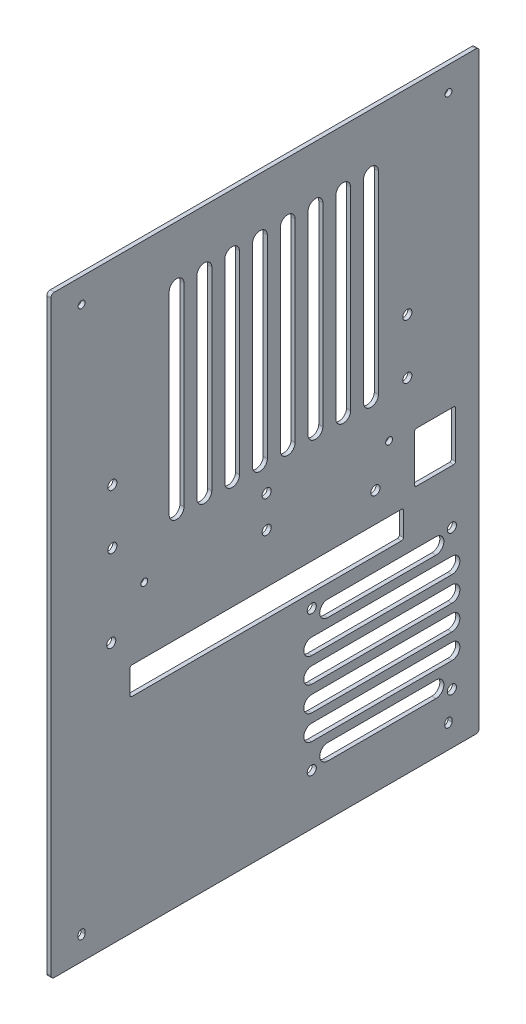
from build123d import *

# Parameters (mm, degrees)
SKETCH_1_W             = 188
SKETCH_1_H             = 260.5
BASE_DEPTH             = 1.8
SKETCH_3_R             = 1.525
SKETCH_3_R_2           = 2
SKETCH_3_R_3           = 1.5
SKETCH_3_W             = 120
SKETCH_3_H             = 12
PCIE_DEPTH             = 1.8
CUT_EXTRUDE_2024_REACH = 323.259
SKETCH_5_W             = 18
SKETCH_5_H             = 22
CUT_EXTRUDE_3211_REACH = 323.259
SKETCH_4_R             = 2
THER_DEPTH             = 1.8
FILLET_1_R             = 1.5
FILLET_2_R             = 0.8


with BuildPart() as part:
    # 草图1 → base (new body)
    with BuildSketch(Plane(origin=(0, 0, 0), x_dir=(0, 0, -1), z_dir=(1, 0, 0))):
        with Locations((94, 130.25)):
            Rectangle(SKETCH_1_W, SKETCH_1_H)
    extrude(amount=BASE_DEPTH)

    # 草图3 → pcie (cut)
    with BuildSketch(Plane(origin=(1.8, 0, 0), x_dir=(0, 0, -1), z_dir=(1, 0, 0))):
        with Locations((13.5, 249.8)):
            Circle(SKETCH_3_R)
        with Locations((174.5, 249.8)):
            Circle(SKETCH_3_R)
        with Locations((156.45, 150.5)):
            Circle(SKETCH_3_R_2)
        with Locations((41, 130.5)):
            Circle(SKETCH_3_R_3)
        with Locations((148.45, 130.5)):
            Circle(SKETCH_3_R_3)
        with Locations((27, 150.5)):
            Circle(SKETCH_3_R_2)
        with Locations((26.5, 114.7)):
            Circle(SKETCH_3_R_2)
        with Locations((142.45, 114.7)):
            Circle(SKETCH_3_R_2)
        with Locations((27, 174.5)):
            Circle(SKETCH_3_R_2)
        with Locations((156.45, 174.5)):
            Circle(SKETCH_3_R_2)
        with Locations((94.725, 137.5)):
            Circle(SKETCH_3_R_2)
        with Locations((94.725, 123.5)):
            Circle(SKETCH_3_R_2)
        with Locations((94.725, 95.8)):
            Rectangle(SKETCH_3_W, SKETCH_3_H)
        with BuildLine():
            Line((15.025, 10.9), (15.025, 9.9))
            ThreePointArc((15.025, 9.9), (13.5, 8.375), (11.975, 9.9))
            Line((11.975, 9.9), (11.975, 10.9))
            ThreePointArc((11.975, 10.9), (13.5, 12.425), (15.025, 10.9))
        make_face()
        with BuildLine():
            Line((176.025, 10.9), (176.025, 9.9))
            ThreePointArc((176.025, 9.9), (174.5, 8.375), (172.975, 9.9))
            Line((172.975, 9.9), (172.975, 10.9))
            ThreePointArc((172.975, 10.9), (174.5, 12.425), (176.025, 10.9))
        make_face()
    extrude(amount=-PCIE_DEPTH, mode=Mode.SUBTRACT)

    # 草图5 → Cut-Extrude 2024 (cut, up to next)
    with BuildSketch(Plane(origin=(1.8, 0, 0), x_dir=(0, 0, -1), z_dir=(1, 0, 0)), mode=Mode.PRIVATE) as cut_extrude_2024_sk1:
        with Locations((168.6, 118.3)):
            Rectangle(SKETCH_5_W, SKETCH_5_H)
    cut_extrude_2024_tool1 = extrude(cut_extrude_2024_sk1.sketch, amount=-CUT_EXTRUDE_2024_REACH, mode=Mode.PRIVATE) & part.part
    add(cut_extrude_2024_tool1.solids().sort_by_distance((1.8, 118.3, -168.6))[0], mode=Mode.SUBTRACT)

    # 草图4 → Cut-Extrude 3211 (cut, up to next)
    with BuildSketch(Plane(origin=(1.8, 0, 0), x_dir=(0, 0, -1), z_dir=(1, 0, 0)), mode=Mode.PRIVATE) as cut_extrude_3211_sk1:
        with Locations((114.5, 83.8)):
            Circle(SKETCH_4_R)
    cut_extrude_3211_tool1 = extrude(cut_extrude_3211_sk1.sketch, amount=-CUT_EXTRUDE_3211_REACH, mode=Mode.PRIVATE) & part.part
    # 草图4 → Cut-Extrude 3211 (cut, up to next)
    with BuildSketch(Plane(origin=(1.8, 0, 0), x_dir=(0, 0, -1), z_dir=(1, 0, 0)), mode=Mode.PRIVATE) as cut_extrude_3211_sk2:
        with Locations((176, 83.8)):
            Circle(SKETCH_4_R)
    cut_extrude_3211_tool2 = extrude(cut_extrude_3211_sk2.sketch, amount=-CUT_EXTRUDE_3211_REACH, mode=Mode.PRIVATE) & part.part
    # 草图4 → Cut-Extrude 3211 (cut, up to next)
    with BuildSketch(Plane(origin=(1.8, 0, 0), x_dir=(0, 0, -1), z_dir=(1, 0, 0)), mode=Mode.PRIVATE) as cut_extrude_3211_sk3:
        with Locations((176, 22.3)):
            Circle(SKETCH_4_R)
    cut_extrude_3211_tool3 = extrude(cut_extrude_3211_sk3.sketch, amount=-CUT_EXTRUDE_3211_REACH, mode=Mode.PRIVATE) & part.part
    # 草图4 → Cut-Extrude 3211 (cut, up to next)
    with BuildSketch(Plane(origin=(1.8, 0, 0), x_dir=(0, 0, -1), z_dir=(1, 0, 0)), mode=Mode.PRIVATE) as cut_extrude_3211_sk4:
        with Locations((114.5, 22.3)):
            Circle(SKETCH_4_R)
    cut_extrude_3211_tool4 = extrude(cut_extrude_3211_sk4.sketch, amount=-CUT_EXTRUDE_3211_REACH, mode=Mode.PRIVATE) & part.part
    add(cut_extrude_3211_tool1.solids().sort_by_distance((1.8, 83.8, -114.5))[0], mode=Mode.SUBTRACT)
    add(cut_extrude_3211_tool2.solids().sort_by_distance((1.8, 83.8, -176))[0], mode=Mode.SUBTRACT)
    add(cut_extrude_3211_tool3.solids().sort_by_distance((1.8, 22.3, -176))[0], mode=Mode.SUBTRACT)
    add(cut_extrude_3211_tool4.solids().sort_by_distance((1.8, 22.3, -114.5))[0], mode=Mode.SUBTRACT)

    # 草图2 → ther (cut)
    with BuildSketch(Plane(origin=(1.8, 0, 0), x_dir=(0, 0, -1), z_dir=(1, 0, 0))):
        with BuildLine():
            Line((58.4375, 235.5), (58.4375, 150.5))
            ThreePointArc((58.4375, 150.5), (55.1875, 147.25), (51.9375, 150.5))
            Line((51.9375, 150.5), (51.9375, 235.5))
            ThreePointArc((51.9375, 235.5), (55.1875, 238.75), (58.4375, 235.5))
        make_face()
        with BuildLine():
            Line((70.625, 235.5), (70.625, 150.5))
            ThreePointArc((70.625, 150.5), (67.375, 147.25), (64.125, 150.5))
            Line((64.125, 150.5), (64.125, 235.5))
            ThreePointArc((64.125, 235.5), (67.375, 238.75), (70.625, 235.5))
        make_face()
        with BuildLine():
            Line((82.8125, 235.5), (82.8125, 150.5))
            ThreePointArc((82.8125, 150.5), (79.5625, 147.25), (76.3125, 150.5))
            Line((76.3125, 150.5), (76.3125, 235.5))
            ThreePointArc((76.3125, 235.5), (79.5625, 238.75), (82.8125, 235.5))
        make_face()
        with BuildLine():
            Line((95, 235.5), (95, 150.5))
            ThreePointArc((95, 150.5), (91.75, 147.25), (88.5, 150.5))
            Line((88.5, 150.5), (88.5, 235.5))
            ThreePointArc((88.5, 235.5), (91.75, 238.75), (95, 235.5))
        make_face()
        with BuildLine():
            Line((107.1875, 235.5), (107.1875, 150.5))
            ThreePointArc((107.1875, 150.5), (103.9375, 147.25), (100.6875, 150.5))
            Line((100.6875, 150.5), (100.6875, 235.5))
            ThreePointArc((100.6875, 235.5), (103.9375, 238.75), (107.1875, 235.5))
        make_face()
        with BuildLine():
            Line((119.375, 235.5), (119.375, 150.5))
            ThreePointArc((119.375, 150.5), (116.125, 147.25), (112.875, 150.5))
            Line((112.875, 150.5), (112.875, 235.5))
            ThreePointArc((112.875, 235.5), (116.125, 238.75), (119.375, 235.5))
        make_face()
        with BuildLine():
            Line((131.5625, 235.5), (131.5625, 150.5))
            ThreePointArc((131.5625, 150.5), (128.3125, 147.25), (125.0625, 150.5))
            Line((125.0625, 150.5), (125.0625, 235.5))
            ThreePointArc((125.0625, 235.5), (128.3125, 238.75), (131.5625, 235.5))
        make_face()
        with BuildLine():
            Line((143.75, 235.5), (143.75, 150.5))
            ThreePointArc((143.75, 150.5), (140.5, 147.25), (137.25, 150.5))
            Line((137.25, 150.5), (137.25, 235.5))
            ThreePointArc((137.25, 235.5), (140.5, 238.75), (143.75, 235.5))
        make_face()
        with BuildLine():
            Line((121.5, 83.8), (169, 83.8))
            ThreePointArc((169, 83.8), (172.5, 80.3), (169, 76.8))
            Line((169, 76.8), (121.5, 76.8))
            ThreePointArc((121.5, 76.8), (118, 80.3), (121.5, 83.8))
        make_face()
        with BuildLine():
            Line((121.5, 29.3), (169, 29.3))
            ThreePointArc((169, 29.3), (172.5, 25.8), (169, 22.3))
            Line((169, 22.3), (121.5, 22.3))
            ThreePointArc((121.5, 22.3), (118, 25.8), (121.5, 29.3))
        make_face()
        with BuildLine():
            Line((114.5, 72.9), (176, 72.9))
            ThreePointArc((176, 72.9), (179.5, 69.4), (176, 65.9))
            Line((176, 65.9), (114.5, 65.9))
            ThreePointArc((114.5, 65.9), (111, 69.4), (114.5, 72.9))
        make_face()
        with BuildLine():
            Line((114.5, 62), (176, 62))
            ThreePointArc((176, 62), (179.5, 58.5), (176, 55))
            Line((176, 55), (114.5, 55))
            ThreePointArc((114.5, 55), (111, 58.5), (114.5, 62))
        make_face()
        with BuildLine():
            Line((114.5, 51.1), (176, 51.1))
            ThreePointArc((176, 51.1), (179.5, 47.6), (176, 44.1))
            Line((176, 44.1), (114.5, 44.1))
            ThreePointArc((114.5, 44.1), (111, 47.6), (114.5, 51.1))
        make_face()
        with BuildLine():
            Line((114.5, 40.2), (176, 40.2))
            ThreePointArc((176, 40.2), (179.5, 36.7), (176, 33.2))
            Line((176, 33.2), (114.5, 33.2))
            ThreePointArc((114.5, 33.2), (111, 36.7), (114.5, 40.2))
        make_face()
    extrude(amount=-THER_DEPTH, mode=Mode.SUBTRACT)

    # 圆角1
    fillet_1_edges = [part.edges().sort_by_distance(p)[0] for p in [
        (0.9, 260.5, 0),
        (0.9, 260.5, -188),
        (0.9, 0, -188),
        (0.9, 0, 0),
    ]]
    fillet(fillet_1_edges, radius=FILLET_1_R)

    # 圆角2
    fillet_2_edges = [part.edges().sort_by_distance(p)[0] for p in [
        (0.9, 107.3, -159.6),
        (0.9, 129.3, -159.6),
        (0.9, 129.3, -177.6),
        (0.9, 107.3, -177.6),
        (0.9, 89.8, -154.725),
        (0.9, 101.8, -154.725),
        (0.9, 101.8, -34.725),
        (0.9, 89.8, -34.725),
    ]]
    fillet(fillet_2_edges, radius=FILLET_2_R)


solid = part.part
